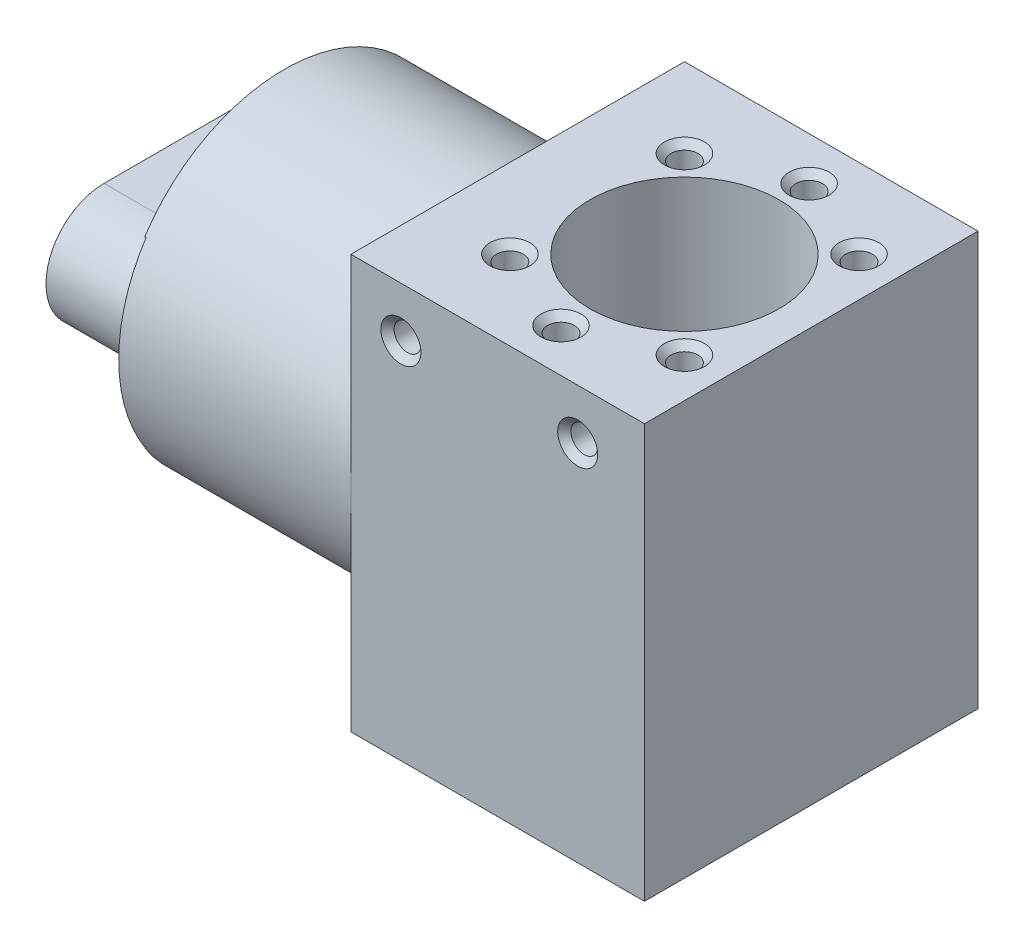
from build123d import *

# Parameters (mm, degrees)
SKETCH3_W                          = 100.33
SKETCH3_H                          = 63.5
BOSS_EXTRUDE3_DEPTH                = 39.37
SKETCH5_OUTSIDE_W                  = 93.994
SKETCH5_OUTSIDE_H                  = 109.234
SKETCH5_OUTSIDE_R                  = 31.75
CUT_EXTRUDE1_DEPTH                 = 44.45
SKETCH6_R                          = 18
CUT_EXTRUDE2_DEPTH                 = 132.431194927
BOSS_EXTRUDE4_DEPTH                = 19.05
CUT_EXTRUDE3_START                 = -0.254
SKETCH12_W                         = 63.5
SKETCH12_H                         = 34.8
CUT_EXTRUDE3_DEPTH                 = 0.254
F_5_16_18_TAPPED_HOLE1_D           = 6.5278
F_5_16_18_TAPPED_HOLE1_DEPTH       = 20.1168
F_5_16_18_TAPPED_HOLE1_CSINK_D     = 9.2075
F_5_16_18_TAPPED_HOLE1_CSINK_ANGLE = 90
F_5_16_18_TAPPED_HOLE1_TIP         = 1.961148974
F_1_4_20_TAPPED_HOLE2_AT_2_COUNT   = 2
F_1_4_20_TAPPED_HOLE2_AT_2_PITCH   = 43.510583459
F_1_4_20_TAPPED_HOLE2_AT_3_COUNT   = 2
F_1_4_20_TAPPED_HOLE2_AT_3_PITCH   = 17.771582008
F_1_4_20_TAPPED_HOLE2_AT_4_COUNT   = 2
F_1_4_20_TAPPED_HOLE2_AT_4_PITCH   = 18.200222467
F_1_4_20_TAPPED_HOLE2_AT_5_COUNT   = 2
F_1_4_20_TAPPED_HOLE2_AT_5_PITCH   = 43.333034767
F_1_4_20_TAPPED_HOLE2_AT_6_COUNT   = 2
F_1_4_20_TAPPED_HOLE2_AT_6_PITCH   = 46.999427507
F_1_4_20_TAPPED_HOLE3_AT_2_COUNT   = 2
F_1_4_20_TAPPED_HOLE3_AT_2_PITCH   = 33.655


with BuildPart() as part:
    # Sketch3 → Boss-Extrude3 (new, symmetric)
    with BuildSketch(Plane(origin=(0, 0, 0), x_dir=(1, 0, 0), z_dir=(0, 1, 0))):
        with Locations((50.165, 0)):
            Rectangle(SKETCH3_W, SKETCH3_H)
    extrude(amount=BOSS_EXTRUDE3_DEPTH, both=True)

    # Sketch5 outside → Cut-Extrude1 (cut)
    with BuildSketch(Plane.ZY):
        Rectangle(SKETCH5_OUTSIDE_W, SKETCH5_OUTSIDE_H)
        Circle(SKETCH5_OUTSIDE_R, mode=Mode.SUBTRACT)
    extrude(amount=-CUT_EXTRUDE1_DEPTH, mode=Mode.SUBTRACT)

    # Sketch6 → Cut-Extrude2 (cut, through all)
    with BuildSketch(Plane(origin=(0, 39.37, 0), x_dir=(1, 0, 0), z_dir=(0, 1, 0))):
        with Locations(Location((76.2, 0, 0), (0, 0, 270))):
            Circle(SKETCH6_R)
    extrude(amount=-CUT_EXTRUDE2_DEPTH, mode=Mode.SUBTRACT)

    # Sketch9 → Boss-Extrude4 (add)
    with BuildSketch(Plane.ZY):
        with BuildLine():
            Line((-15.24, 11.05), (15.24, 11.05))
            ThreePointArc((15.24, 11.05), (26.29, 0), (15.24, -11.05))
            Line((15.24, -11.05), (-15.24, -11.05))
            ThreePointArc((-15.24, -11.05), (-26.29, 0), (-15.24, 11.05))
        make_face()
    extrude(amount=BOSS_EXTRUDE4_DEPTH)

    # Sketch12 → Cut-Extrude3 (cut)
    with BuildSketch(Plane.ZY.offset(CUT_EXTRUDE3_START)):
        Rectangle(SKETCH12_W, SKETCH12_H)
        with BuildLine():
            Line((-15.24, -11.05), (15.24, -11.05))
            ThreePointArc((15.24, -11.05), (26.29, 0), (15.24, 11.05))
            Line((15.24, 11.05), (-15.24, 11.05))
            ThreePointArc((-15.24, 11.05), (-26.29, 0), (-15.24, -11.05))
        make_face(mode=Mode.SUBTRACT)
    extrude(amount=CUT_EXTRUDE3_DEPTH, mode=Mode.SUBTRACT)

    # 5/16-18 Tapped Hole1
    with Locations(Plane.ZY.offset(19.05)):
        with Locations((-15.24, 0), (15.24, 0)):
            CounterSinkHole(F_5_16_18_TAPPED_HOLE1_D / 2, F_5_16_18_TAPPED_HOLE1_CSINK_D / 2, depth=F_5_16_18_TAPPED_HOLE1_DEPTH, counter_sink_angle=F_5_16_18_TAPPED_HOLE1_CSINK_ANGLE)
            with Locations((0, 0, -(F_5_16_18_TAPPED_HOLE1_DEPTH + F_5_16_18_TAPPED_HOLE1_TIP / 2))):  # 118° drill point
                Cone(0, F_5_16_18_TAPPED_HOLE1_D / 2, F_5_16_18_TAPPED_HOLE1_TIP, mode=Mode.SUBTRACT)

    # Sketch7 → 1/4-20 Tapped Hole2 (revolve, cut)
    with BuildSketch(Plane(origin=(76.431975719, 39.37, -23.49885502), x_dir=(0, 0, 1), z_dir=(1, 0, 0))):
        Polygon((0, 0), (0, 18.043816902), (2.5527, 16.51), (2.5527, 1.2573), (3.81, 0), align=None)
    f_1_4_20_tapped_hole2 = revolve(axis=Axis((76.431975719, 45.72, -23.49885502), (0, -1, 0)), mode=Mode.SUBTRACT)

    # 1/4-20 Tapped Hole2 at 2: 1/4-20 Tapped Hole2 ×2
    with Locations(*[Vector(-0.38723877589339034, 0, 0.9219794631360227) * (i * F_1_4_20_TAPPED_HOLE2_AT_2_PITCH) for i in range(1, F_1_4_20_TAPPED_HOLE2_AT_2_COUNT)]):
        add(f_1_4_20_tapped_hole2, mode=Mode.SUBTRACT)

    # 1/4-20 Tapped Hole2 at 3: 1/4-20 Tapped Hole2 ×2
    with Locations(*[Vector(0.9219794631360225, 0, 0.3872387758933909) * (i * F_1_4_20_TAPPED_HOLE2_AT_3_PITCH) for i in range(1, F_1_4_20_TAPPED_HOLE2_AT_3_COUNT)]):
        add(f_1_4_20_tapped_hole2, mode=Mode.SUBTRACT)

    # 1/4-20 Tapped Hole2 at 4: 1/4-20 Tapped Hole2 ×2
    with Locations(*[Vector(-0.9257570948708089, 0, 0.37811876612561857) * (i * F_1_4_20_TAPPED_HOLE2_AT_4_PITCH) for i in range(1, F_1_4_20_TAPPED_HOLE2_AT_4_COUNT)]):
        add(f_1_4_20_tapped_hole2, mode=Mode.SUBTRACT)

    # 1/4-20 Tapped Hole2 at 5: 1/4-20 Tapped Hole2 ×2
    with Locations(*[Vector(0.37811876612561857, 0, 0.9257570948708089) * (i * F_1_4_20_TAPPED_HOLE2_AT_5_PITCH) for i in range(1, F_1_4_20_TAPPED_HOLE2_AT_5_COUNT)]):
        add(f_1_4_20_tapped_hole2, mode=Mode.SUBTRACT)

    # 1/4-20 Tapped Hole2 at 6: 1/4-20 Tapped Hole2 ×2
    with Locations(*[Vector(-0.004935713719611744, 0, 0.9999878192908542) * (i * F_1_4_20_TAPPED_HOLE2_AT_6_PITCH) for i in range(1, F_1_4_20_TAPPED_HOLE2_AT_6_COUNT)]):
        add(f_1_4_20_tapped_hole2, mode=Mode.SUBTRACT)

    # Mirror1: 1/4-20 Tapped Hole2 across plane
    add(f_1_4_20_tapped_hole2.mirror(Plane.ZX), mode=Mode.SUBTRACT)

    # Mirror1 copy 1 sketch → Mirror1 copy 1 (revolve, cut)
    with BuildSketch(Plane(origin=(59.582990642, -39.37, 16.617009358), x_dir=(0, 0, 1), z_dir=(1, 0, 0))):
        Polygon((0, 0), (0, -18.043816902), (2.5527, -16.51), (2.5527, -1.2573), (3.81, 0), align=None)
    revolve(axis=Axis((59.582990642, -45.72, 16.617009358), (0, -1, 0)), mode=Mode.SUBTRACT)

    # Mirror1 copy 2 sketch → Mirror1 copy 2 (revolve, cut)
    with BuildSketch(Plane(origin=(92.817009358, -39.37, -16.617009358), x_dir=(0, 0, 1), z_dir=(1, 0, 0))):
        Polygon((0, 0), (0, -18.043816902), (2.5527, -16.51), (2.5527, -1.2573), (3.81, 0), align=None)
    revolve(axis=Axis((92.817009358, -45.72, -16.617009358), (0, -1, 0)), mode=Mode.SUBTRACT)

    # Mirror1 copy 3 sketch → Mirror1 copy 3 (revolve, cut)
    with BuildSketch(Plane(origin=(59.582990642, -39.37, -16.617009358), x_dir=(0, 0, 1), z_dir=(1, 0, 0))):
        Polygon((0, 0), (0, -18.043816902), (2.5527, -16.51), (2.5527, -1.2573), (3.81, 0), align=None)
    revolve(axis=Axis((59.582990642, -45.72, -16.617009358), (0, -1, 0)), mode=Mode.SUBTRACT)

    # Mirror1 copy 4 sketch → Mirror1 copy 4 (revolve, cut)
    with BuildSketch(Plane(origin=(92.817009358, -39.37, 16.617009358), x_dir=(0, 0, 1), z_dir=(1, 0, 0))):
        Polygon((0, 0), (0, -18.043816902), (2.5527, -16.51), (2.5527, -1.2573), (3.81, 0), align=None)
    revolve(axis=Axis((92.817009358, -45.72, 16.617009358), (0, -1, 0)), mode=Mode.SUBTRACT)

    # Mirror1 copy 5 sketch → Mirror1 copy 5 (revolve, cut)
    with BuildSketch(Plane(origin=(76.2, -39.37, 23.5), x_dir=(0, 0, 1), z_dir=(1, 0, 0))):
        Polygon((0, 0), (0, -18.043816902), (2.5527, -16.51), (2.5527, -1.2573), (3.81, 0), align=None)
    revolve(axis=Axis((76.2, -45.72, 23.5), (0, -1, 0)), mode=Mode.SUBTRACT)

    # Sketch13 → 1/4-20 Tapped Hole3 (revolve, cut)
    with BuildSketch(Plane(origin=(53.975, 29.845, 31.75), x_dir=(0, -1, 0), z_dir=(1, 0, 0))):
        Polygon((0, 0), (0, 18.043816902), (2.5527, 16.51), (2.5527, 1.2573), (3.81, 0), align=None)
    f_1_4_20_tapped_hole3 = revolve(axis=Axis((53.975, 29.845, 38.1), (0, 0, -1)), mode=Mode.SUBTRACT)

    # 1/4-20 Tapped Hole3 at 2: 1/4-20 Tapped Hole3 ×2
    with Locations(*[(i * F_1_4_20_TAPPED_HOLE3_AT_2_PITCH, 0, 0) for i in range(1, F_1_4_20_TAPPED_HOLE3_AT_2_COUNT)]):
        add(f_1_4_20_tapped_hole3, mode=Mode.SUBTRACT)

    # Mirror2: 1/4-20 Tapped Hole3 across plane
    add(f_1_4_20_tapped_hole3.mirror(Plane.XY), mode=Mode.SUBTRACT)

    # Mirror2 copy 1 sketch → Mirror2 copy 1 (revolve, cut)
    with BuildSketch(Plane(origin=(87.63, 29.845, -31.75), x_dir=(0, -1, 0), z_dir=(1, 0, 0))):
        Polygon((0, 0), (0, -18.043816902), (2.5527, -16.51), (2.5527, -1.2573), (3.81, 0), align=None)
    revolve(axis=Axis((87.63, 29.845, -38.1), (0, 0, -1)), mode=Mode.SUBTRACT)


solid = part.part
